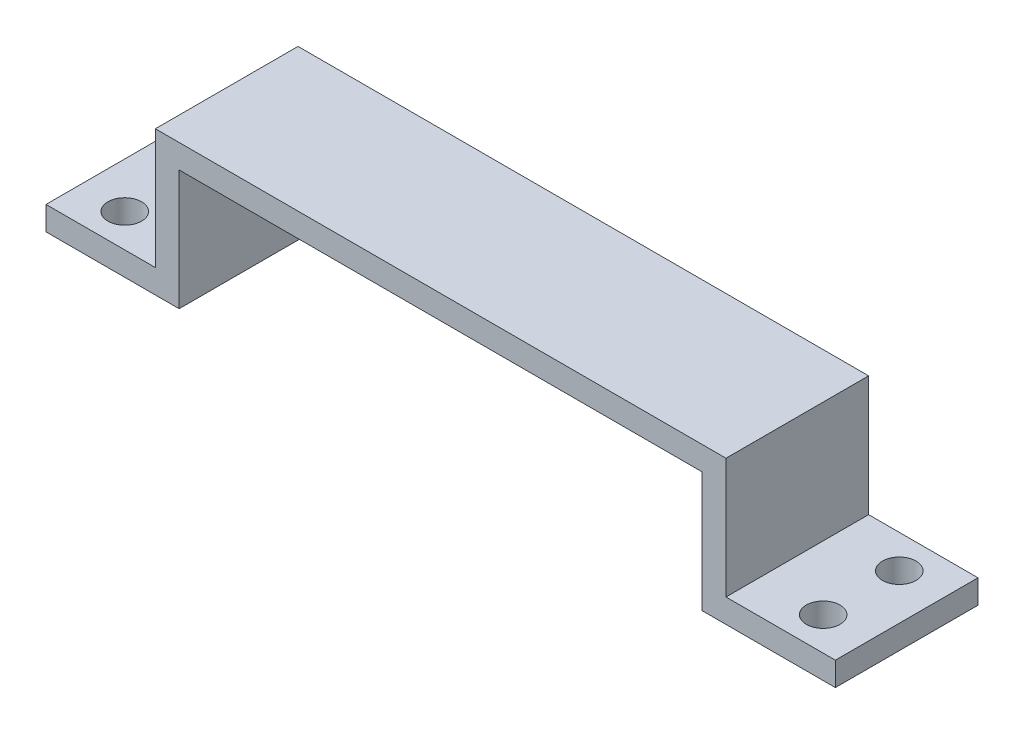
from build123d import *

# Parameters (mm, degrees)
EXTRUDE1_DEPTH        = 19.05
F_8_CLEARANCE_HOLE1_D = 4.4958


with BuildPart() as part:
    # Sketch1 → Extrude1 (new body)
    with BuildSketch(Plane.XY):
        Polygon((0, 0), (-38.1, 0), (-38.1, -16.0528), (-52.705, -16.0528), (-52.705, -19.2278), (-34.925, -19.2278), (-34.925, -3.175), (0, -3.175), align=None)
    extrude1 = extrude(amount=EXTRUDE1_DEPTH)

    # #8 Clearance Hole1 (through all)
    with Locations(Plane(origin=(-46.6344, -16.0528, 4.445), x_dir=(1, 0, 0), z_dir=(0, 1, 0))):
        with Locations((0, 0), (0, -10.16)):
            f_8_clearance_hole1 = Hole(F_8_CLEARANCE_HOLE1_D / 2)

    # Mirror1: Extrude1, #8 Clearance Hole1 across plane
    add(extrude1.mirror(Plane(origin=(0, 0, 0), x_dir=(0, 0, 1), z_dir=(1, 0, 0))))
    add(f_8_clearance_hole1.mirror(Plane(origin=(0, 0, 0), x_dir=(0, 0, 1), z_dir=(1, 0, 0))), mode=Mode.SUBTRACT)


solid = part.part
